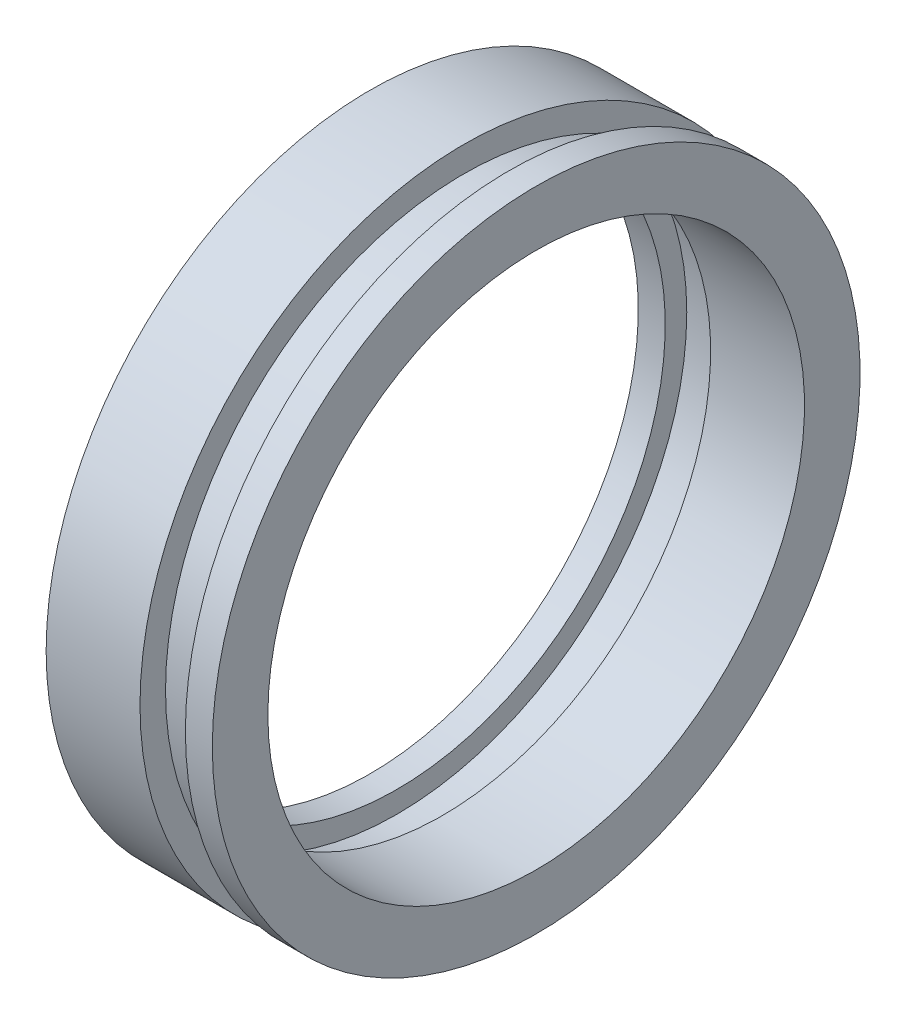
from build123d import *


with BuildPart() as part:
    # Sketch1 → Revolve1 (revolve)
    with BuildSketch(Plane.XY, mode=Mode.PRIVATE) as revolve1_sk:
        Polygon((0, 28.829), (0, 34.798), (10.0838, 34.798), (10.0838, 32.0548), (14.9606, 32.0548), (14.9606, 34.798), (17.8562, 34.798), (17.8562, 28.829), (7.7724, 28.829), (7.7724, 31.1404), (2.8956, 31.1404), (2.8956, 28.829), align=None)
    revolve(revolve1_sk.sketch.rotate(Axis((0, 0, 0), (1, 0, 0)), 90), axis=Axis((0, 0, 0), (1, 0, 0)))


solid = part.part
